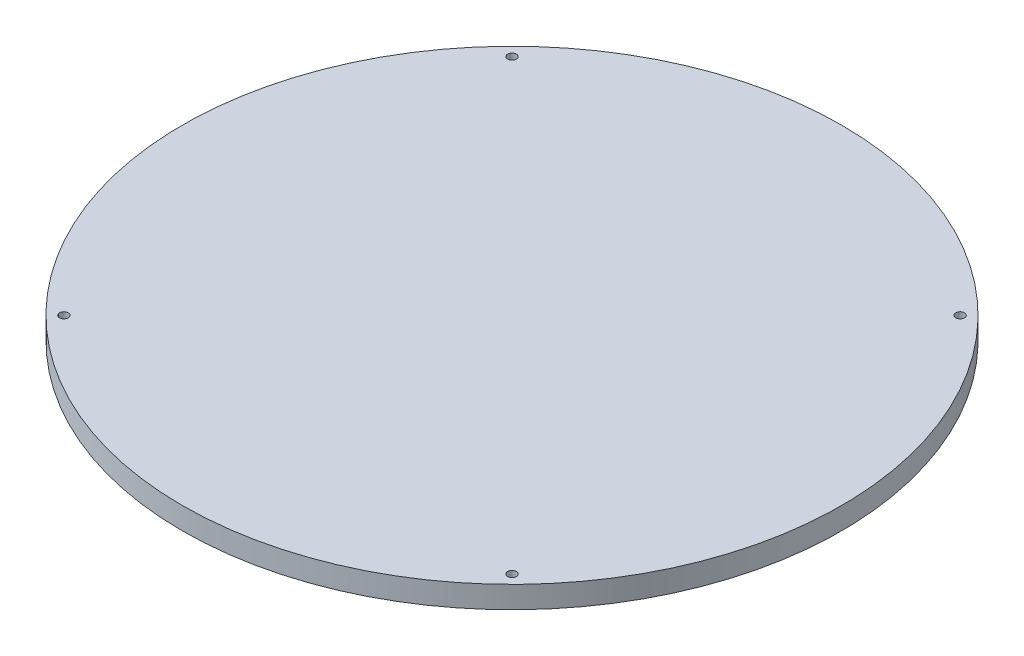
from build123d import *

# Parameters (mm, degrees)
SKETCH1_R           = 150
BOSS_EXTRUDE1_DEPTH = 10
SKETCH2_R           = 2
CUT_EXTRUDE1_DEPTH  = 10


with BuildPart() as part:
    # Sketch1 → Boss-Extrude1 (new body)
    with BuildSketch(Plane(origin=(0, 0, 0), x_dir=(1, 0, 0), z_dir=(0, 1, 0))):
        with Locations(Location((0, 0, 0), (0, 0, 270))):
            Circle(SKETCH1_R)
    extrude(amount=BOSS_EXTRUDE1_DEPTH)

    # Sketch2 → Cut-Extrude1 (cut)
    with BuildSketch(Plane(origin=(0, 10, 0), x_dir=(1, 0, 0), z_dir=(0, 1, 0))):
        with Locations(Location((101.974532959, 101.974532959, 0), (0, 0, 270))):
            Circle(SKETCH2_R)
        with Locations(Location((101.974532959, -101.974532959, 0), (0, 0, 270))):
            Circle(SKETCH2_R)
        with Locations(Location((-101.974532959, -101.974532959, 0), (0, 0, 270))):
            Circle(SKETCH2_R)
        with Locations(Location((-101.974532959, 101.974532959, 0), (0, 0, 270))):
            Circle(SKETCH2_R)
    extrude(amount=-CUT_EXTRUDE1_DEPTH, mode=Mode.SUBTRACT)


solid = part.part
